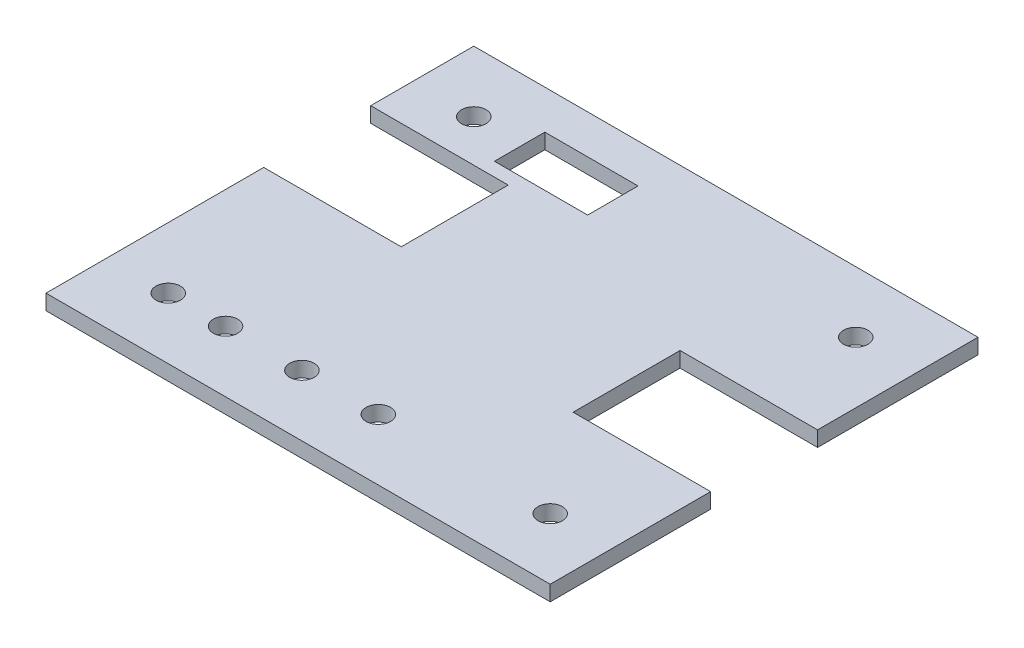
from build123d import *

# Parameters (mm, degrees)
SKETCH_1_W                  = 66
SKETCH_1_H                  = 56
EXTRUDE_1_DEPTH             = 2
SKETCH_2_R                  = 1.6
CUT_EXTRUDE_1_DEPTH         = 2
PATTERN_LINEAR_1_COUNT      = 2
PATTERN_LINEAR_1_PITCH      = 50
PATTERN_LINEAR_1_COUNT_DIR2 = 2
PATTERN_LINEAR_1_PITCH_DIR2 = 40
SKETCH_4_R                  = 1.6
CUT_EXTRUDE_2_DEPTH         = 2
SKETCH_5_W                  = 18
SKETCH_5_H                  = 14
CUT_EXTRUDE_3_DEPTH         = 2
SKETCH_7_W                  = 18
SKETCH_7_H                  = 14
CUT_EXTRUDE_4_DEPTH         = 2
SKETCH_8_W                  = 12.2
SKETCH_8_H                  = 6.6
CUT_EXTRUDE_5_DEPTH         = 2


with BuildPart() as part:
    # 草图1 → 凸台-拉伸1 (new body)
    with BuildSketch(Plane(origin=(0, 0, 0), x_dir=(1, 0, 0), z_dir=(0, 1, 0))):
        Rectangle(SKETCH_1_W, SKETCH_1_H)
    extrude(amount=EXTRUDE_1_DEPTH)

    # 草图2 → 切除-拉伸1 (cut)
    with BuildSketch(Plane(origin=(0, 2, 0), x_dir=(1, 0, 0), z_dir=(0, 1, 0))):
        with Locations(Location((-25, 20, 0), (0, 0, 270))):
            Circle(SKETCH_2_R)
    cut_extrude_1 = extrude(amount=-CUT_EXTRUDE_1_DEPTH, mode=Mode.SUBTRACT)

    # 阵列(线性)1: Cut-Extrude 1 2 × 2
    with Locations(*[(i * PATTERN_LINEAR_1_PITCH, 0, j * PATTERN_LINEAR_1_PITCH_DIR2) for i in range(PATTERN_LINEAR_1_COUNT) for j in range(PATTERN_LINEAR_1_COUNT_DIR2) if (i, j) != (0, 0)]):
        add(cut_extrude_1, mode=Mode.SUBTRACT)

    # 草图4 → 切除-拉伸2 (cut)
    with BuildSketch(Plane.XZ):
        with Locations(Location((-17.49998476, 20.00007874, 0), (0, 0, 270))):
            Circle(SKETCH_4_R)
        with Locations(Location((-7.49996444, 20.00007874, 0), (0, 0, 270))):
            Circle(SKETCH_4_R)
        with Locations(Location((2.49985522, 19.999735839, 0), (0, 0, 270))):
            Circle(SKETCH_4_R)
    extrude(amount=-CUT_EXTRUDE_2_DEPTH, mode=Mode.SUBTRACT)

    # 草图5 → 切除-拉伸3 (cut)
    with BuildSketch(Plane.XZ):
        with Locations((24, 0)):
            Rectangle(SKETCH_5_W, SKETCH_5_H)
    extrude(amount=-CUT_EXTRUDE_3_DEPTH, mode=Mode.SUBTRACT)

    # 草图7 → 切除-拉伸4 (cut)
    with BuildSketch(Plane.XZ):
        with Locations((-24, -7.5)):
            Rectangle(SKETCH_7_W, SKETCH_7_H)
    extrude(amount=-CUT_EXTRUDE_4_DEPTH, mode=Mode.SUBTRACT)

    # 草图8 → 切除-拉伸5 (cut)
    with BuildSketch(Plane(origin=(0, 2, 0), x_dir=(1, 0, 0), z_dir=(0, 1, 0))):
        with Locations((-12.4999746, 19.599995025)):
            Rectangle(SKETCH_8_W, SKETCH_8_H)
    extrude(amount=-CUT_EXTRUDE_5_DEPTH, mode=Mode.SUBTRACT)


solid = part.part
